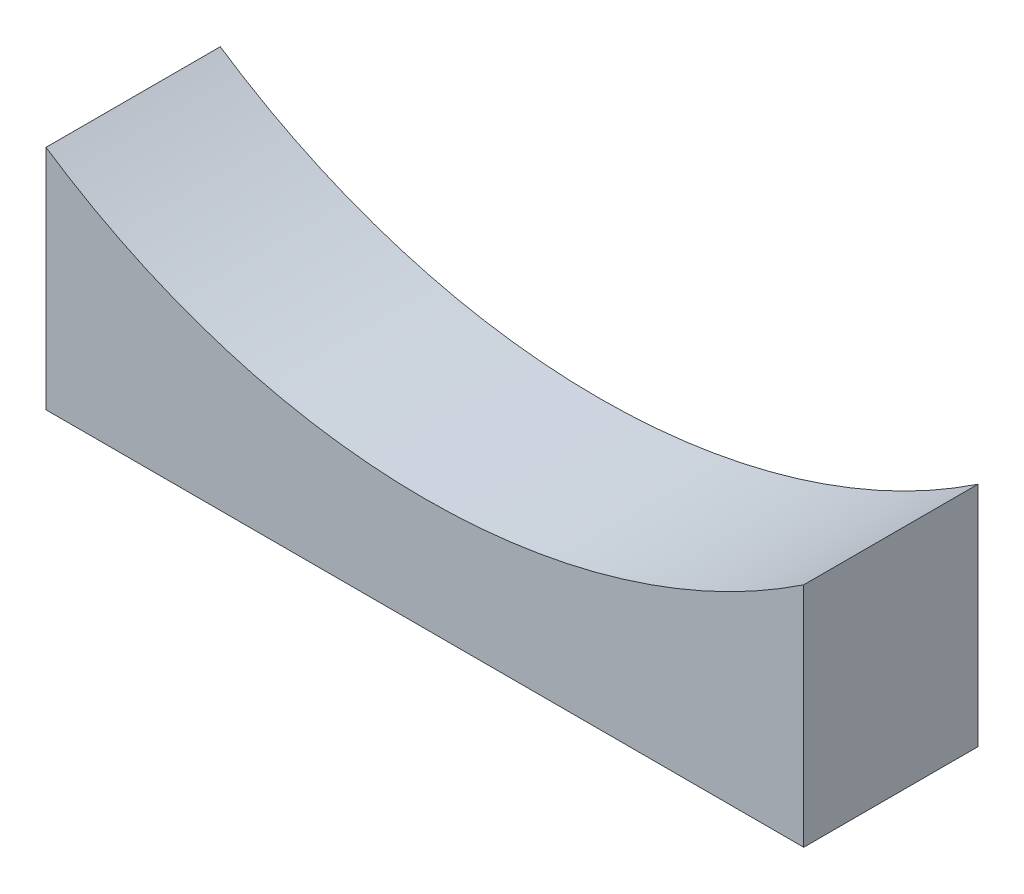
from build123d import *

# Parameters (mm, degrees)
BOSS_EXTRUDE1_DEPTH = 146.05


with BuildPart() as part:
    # Sketch1 → Boss-Extrude1 (new body)
    with BuildSketch(Plane.XY):
        with BuildLine():
            Line((0, 0), (635, 0))
            Line((635, 0), (635, 190.5))
            ThreePointArc((635, 190.5), (317.5, 94.19048812), (0, 190.5))
            Line((0, 190.5), (0, 0))
        make_face()
    extrude(amount=BOSS_EXTRUDE1_DEPTH)


solid = part.part
